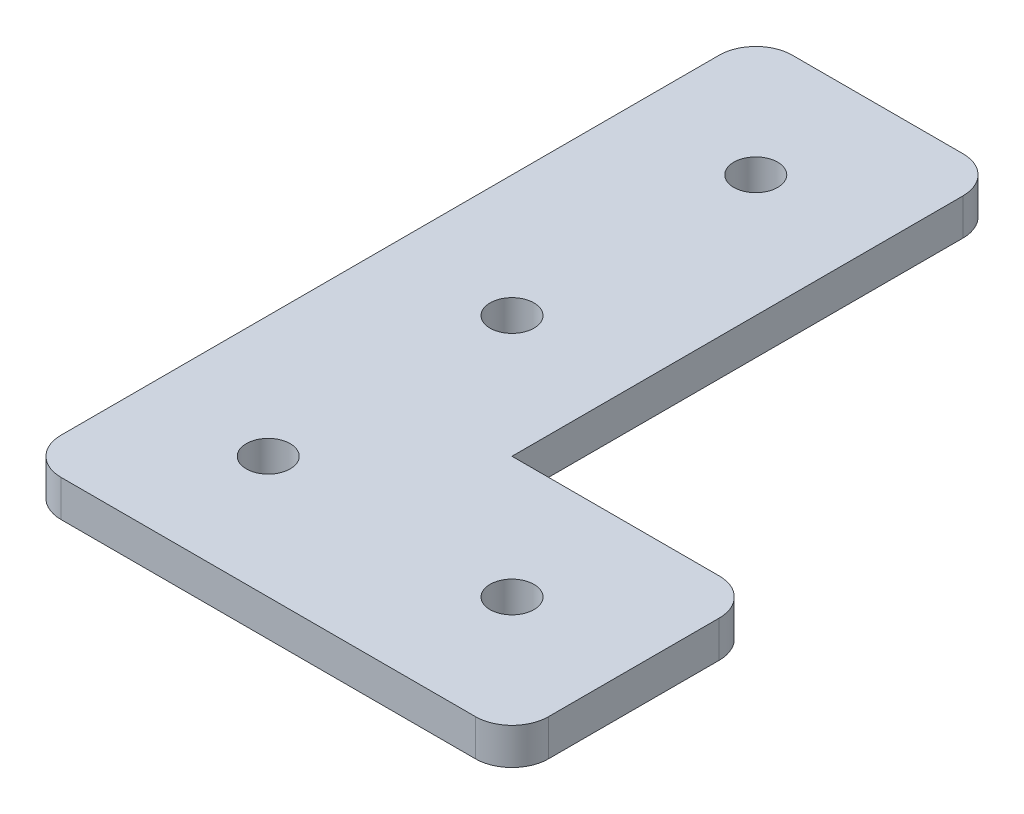
from build123d import *

# Parameters (mm, degrees)
SKETCH_1_W      = 20
SKETCH_1_H      = 40
SKETCH_1_R      = 1.8
SKETCH_1_W_2    = 40
SKETCH_1_H_2    = 20
EXTRUDE_1_DEPTH = 3
FILLET_1_R      = 3


with BuildPart() as part:
    # 草图1 → 凸台-拉伸1 (new body)
    # profile 1 of 2: a face of its own
    with BuildSketch(Plane(origin=(0, 0, 0), x_dir=(1, 0, 0), z_dir=(0, 1, 0))):
        with Locations((-10, 30)):
            Rectangle(SKETCH_1_W, SKETCH_1_H)
        with Locations(Location((-10, 20, 0), (0, 0, 270))):
            Circle(SKETCH_1_R, mode=Mode.SUBTRACT)
        with Locations(Location((-10, 40, 0), (0, 0, 270))):
            Circle(SKETCH_1_R, mode=Mode.SUBTRACT)
    # profile 2 of 2: a face of its own
    with BuildSketch(Plane(origin=(0, 0, 0), x_dir=(1, 0, 0), z_dir=(0, 1, 0))):
        Rectangle(SKETCH_1_W_2, SKETCH_1_H_2)
        with Locations(Location((10, 0, 0), (0, 0, 270))):
            Circle(SKETCH_1_R, mode=Mode.SUBTRACT)
        with Locations(Location((-10, 0, 0), (0, 0, 270))):
            Circle(SKETCH_1_R, mode=Mode.SUBTRACT)
    extrude(amount=EXTRUDE_1_DEPTH)

    # 圆角1
    fillet_1_edges = [part.edges().sort_by_distance(p)[0] for p in [
        (-20, 1.5, -50),
        (0, 1.5, -50),
        (20, 1.5, -10),
        (20, 1.5, 10),
        (-20, 1.5, 10),
    ]]
    fillet(fillet_1_edges, radius=FILLET_1_R)


solid = part.part
